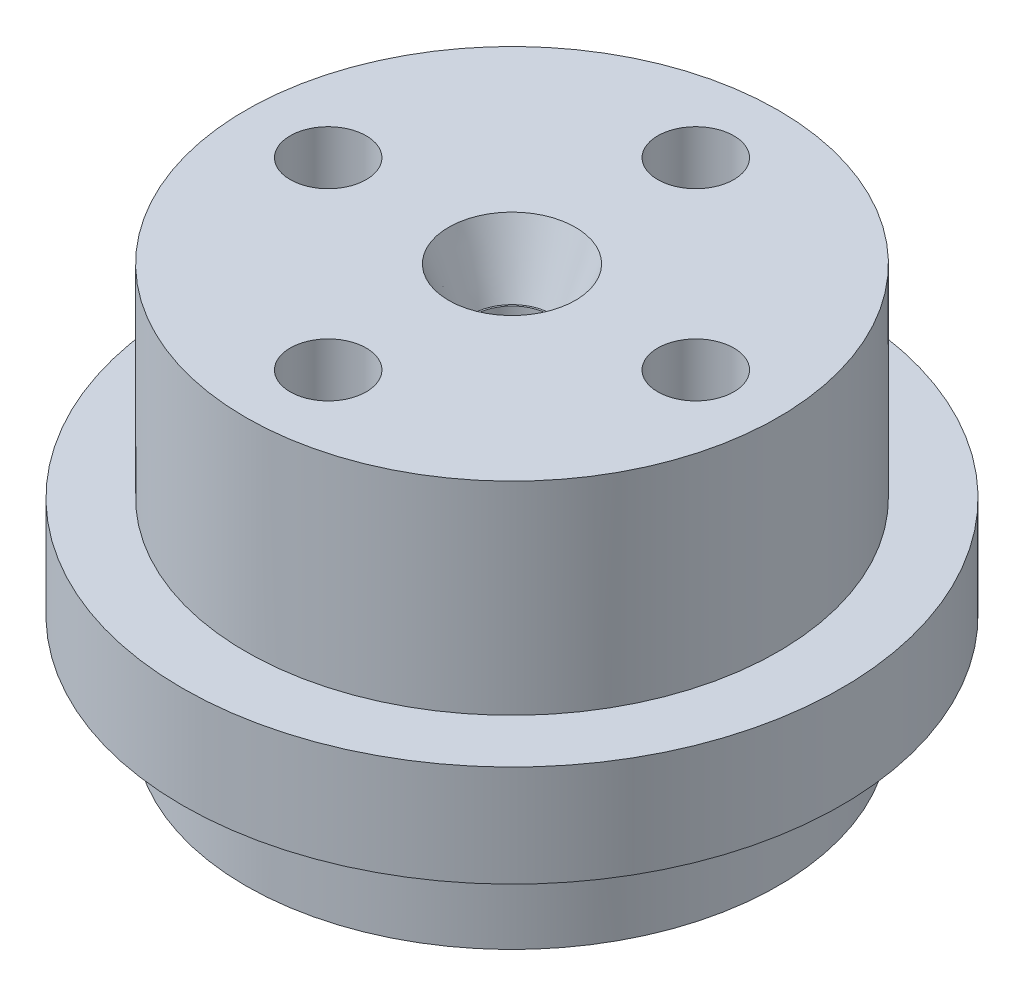
from build123d import *

# Parameters (mm, degrees)
SKETCH1_R                = 10.5
BOSS_EXTRUDE1_DEPTH      = 16
SKETCH2_R                = 1.5
CUT_EXTRUDE1_DEPTH       = 22.828879953
SKETCH3_R                = 2.5
CUT_EXTRUDE2_DEPTH       = 2.5
CUT_EXTRUDE2_DRAFT       = -20.5
BOSS_EXTRUDE2_DEPTH      = 2
BOSS_EXTRUDE2_DEPTH_BACK = 2
SKETCH5_R                = 13
SKETCH7_R                = 1.5
CUT_EXTRUDE3_DEPTH       = 10
SKETCH8_R                = 1
CUT_EXTRUDE4_DEPTH       = 21.928449536
SKETCH9_R                = 1.5
CUT_EXTRUDE5_DEPTH       = 25.372115214


with BuildPart() as part:
    # Sketch1 → Boss-Extrude1 (new body)
    with BuildSketch(Plane(origin=(0, 0, 0), x_dir=(1, 0, 0), z_dir=(0, 1, 0))):
        with Locations(Location((0, 0, 0), (0, 0, 270))):
            Circle(SKETCH1_R)
    extrude(amount=BOSS_EXTRUDE1_DEPTH)

    # Sketch2 → Cut-Extrude1 (cut, through all)
    with BuildSketch(Plane(origin=(0, 16, 0), x_dir=(1, 0, 0), z_dir=(0, 1, 0))):
        with Locations(Location((0, 0, 0), (0, 0, 270))):
            Circle(SKETCH2_R)
    extrude(amount=-CUT_EXTRUDE1_DEPTH, mode=Mode.SUBTRACT)


with BuildPart() as cut_extrude2_tool:
    # Sketch3 → Cut-Extrude2 (with draft: the straight prism first)
    with BuildSketch(Plane(origin=(0, 16, 0), x_dir=(1, 0, 0), z_dir=(0, 1, 0))):
        Circle(SKETCH3_R)
    extrude(amount=-CUT_EXTRUDE2_DEPTH)
    # Cut-Extrude2: the draft: its side faces are tilted about the plane it starts from
    cut_extrude2_sides = [cut_extrude2_tool.faces().sort_by_distance(p)[0] for p in [
        (-2.5, 14.75, 0),
    ]]
    draft(cut_extrude2_sides, Plane(origin=(0, 16, 0), x_dir=(1, 0, 0), z_dir=(0, 1, 0)), CUT_EXTRUDE2_DRAFT)


with BuildPart() as part_1:
    add(part.part)

    # Cut-Extrude2: cut by cut_extrude2_tool
    add(cut_extrude2_tool.part, mode=Mode.SUBTRACT)

    # Sketch5 → Boss-Extrude2 (add, two sides: drawn at the far end of the back side and taken through both)
    with BuildSketch(Plane(origin=(0, 6, 0), x_dir=(-1, 0, 0), z_dir=(0, -1, 0)).offset(-BOSS_EXTRUDE2_DEPTH_BACK)):
        with Locations(Location((0, 0, 0), (0, 0, 90))):
            Circle(SKETCH5_R)
    extrude(amount=BOSS_EXTRUDE2_DEPTH + BOSS_EXTRUDE2_DEPTH_BACK)

    # Sketch7 → Cut-Extrude3 (cut)
    with BuildSketch(Plane(origin=(0, 16, 0), x_dir=(1, 0, 0), z_dir=(0, 1, 0))):
        with Locations(Location((0, 7.25, 0), (0, 0, 270))):
            Circle(SKETCH7_R)
        with Locations(Location((7.25, 0, 0), (0, 0, 270))):
            Circle(SKETCH7_R)
        with Locations(Location((0, -7.25, 0), (0, 0, 270))):
            Circle(SKETCH7_R)
        with Locations(Location((-7.25, 0, 0), (0, 0, 270))):
            Circle(SKETCH7_R)
    extrude(amount=-CUT_EXTRUDE3_DEPTH, mode=Mode.SUBTRACT)

    # Sketch8 → Cut-Extrude4 (cut, through all)
    with BuildSketch(Plane(origin=(0, 6, 0), x_dir=(1, 0, 0), z_dir=(0, 1, 0))):
        with Locations(Location((-7.25, 0, 0), (0, 0, 270))):
            Circle(SKETCH8_R)
        with Locations(Location((0, 7.25, 0), (0, 0, 270))):
            Circle(SKETCH8_R)
        with Locations(Location((7.25, 0, 0), (0, 0, 270))):
            Circle(SKETCH8_R)
        with Locations(Location((0, -7.25, 0), (0, 0, 270))):
            Circle(SKETCH8_R)
    extrude(amount=-CUT_EXTRUDE4_DEPTH, mode=Mode.SUBTRACT)

    # Sketch9 → Cut-Extrude5 (cut, through all)
    with BuildSketch(Plane(origin=(0, 16, 0), x_dir=(1, 0, 0), z_dir=(0, 1, 0))):
        with Locations(Location((0, 0, 0), (0, 0, 270))):
            Circle(SKETCH9_R)
    extrude(amount=-CUT_EXTRUDE5_DEPTH, mode=Mode.SUBTRACT)


solid = part_1.part
